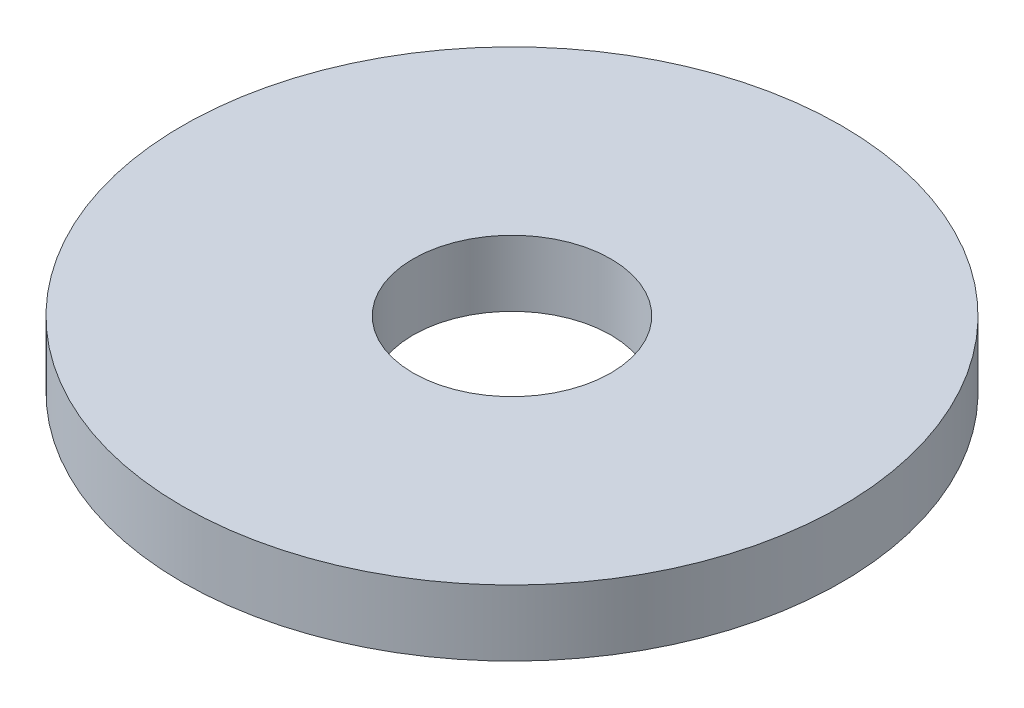
from build123d import *

# Parameters (mm, degrees)
SKETCH_1_R      = 5
SKETCH_1_R_2    = 1.5
EXTRUDE_3_DEPTH = 1


with BuildPart() as part:
    # 草图1 → 凸台-拉伸3 (new body)
    with BuildSketch(Plane(origin=(0, 0, 0), x_dir=(1, 0, 0), z_dir=(0, 1, 0))):
        with Locations(Location((0, 0, 0), (0, 0, 270))):
            Circle(SKETCH_1_R)
        with Locations(Location((0, 0, 0), (0, 0, 270))):
            Circle(SKETCH_1_R_2, mode=Mode.SUBTRACT)
    extrude(amount=EXTRUDE_3_DEPTH)


solid = part.part
